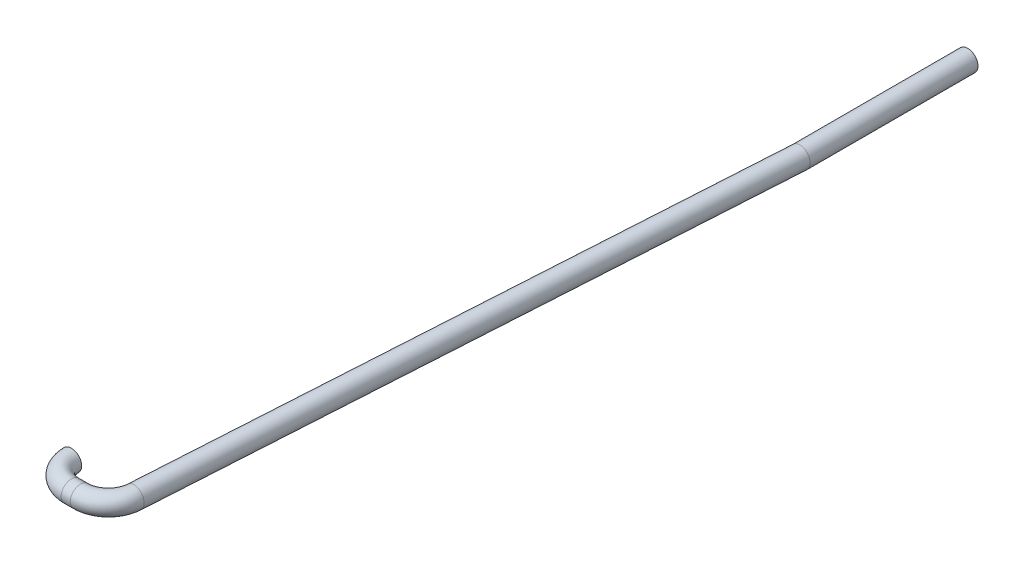
from build123d import *

# Parameters (mm, degrees)
SKETCH7_R   = 7.34
SKETCH7_R_2 = 6.34


with BuildPart() as part:
    # Sweep-Thin1: sweep along a path in Sketch1
    with BuildLine(Plane(origin=(0, 0, 0), x_dir=(1, 0, 0), z_dir=(0, 1, 0))) as sweep_thin1_path:
        Line((-186.112466625, 25.587240645), (-186.112466625, -94.412759355))
        Line((-186.112466625, -94.412759355), (-213.584309415, -543.573418645))
        ThreePointArc((-213.584309415, -543.573418645), (-219.843345577, -556.919867252), (-233.547005384, -562.352447854))
        Line((-233.547005384, -562.352447854), (-240.047005384, -562.352447854))
        ThreePointArc((-240.047005384, -562.352447854), (-253.482034226, -556.787476697), (-259.047005384, -543.352447854))
    # Sketch7 → Sweep-Thin1 (sweep)
    with BuildSketch(Plane(origin=(-259.047005384, 0, 543.352447854), x_dir=(-1, 0, 0), z_dir=(0, 0, -1))):
        Circle(SKETCH7_R)
        Circle(SKETCH7_R_2, mode=Mode.SUBTRACT)
    sweep(path=sweep_thin1_path.line, transition=Transition.RIGHT)


solid = part.part
